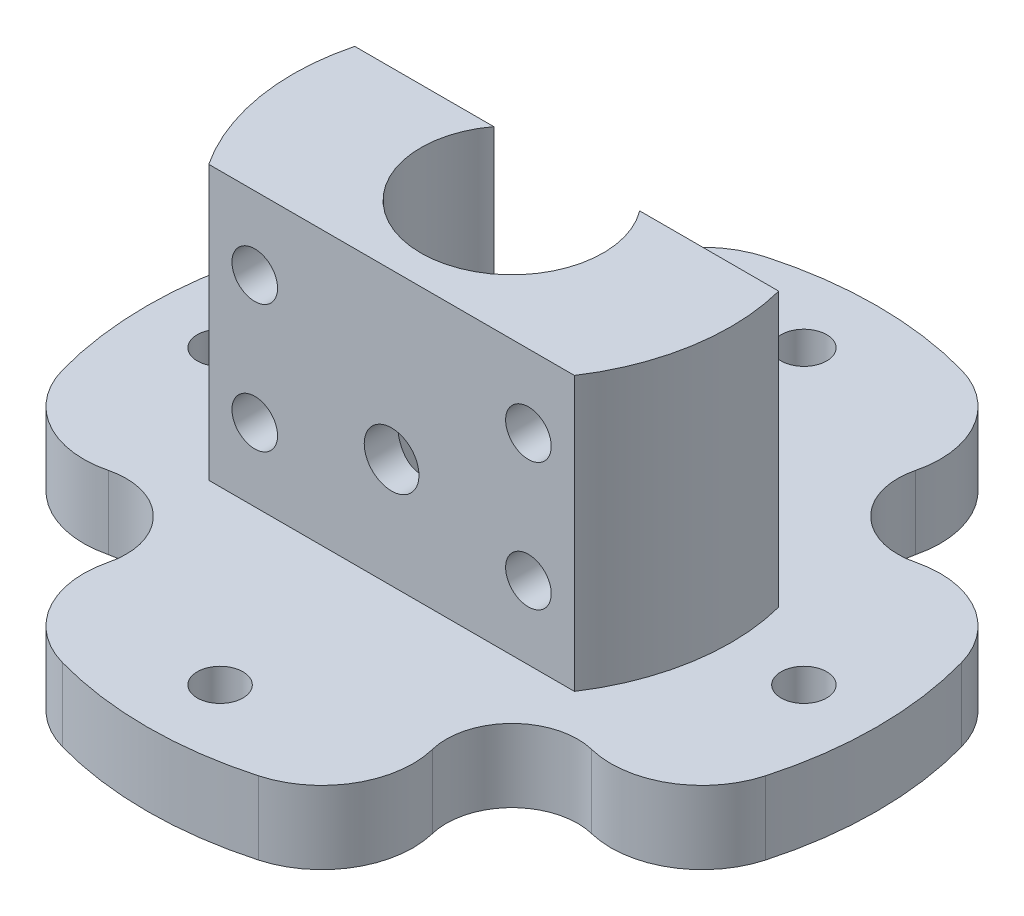
from build123d import *
from build123d.topology import SkipClean

# Parameters (mm, degrees)
EXTRUDE_1_DEPTH     = 15
EXTRUDE_START       = -4
SKETCH_3_R          = 20
SKETCH_3_R_2        = 1.25
SKETCH_3_R_3        = 5
EXTRUDE_2_DEPTH     = 4
SKETCH_4_R          = 3.6
CUT_EXTRUDE_1_DEPTH = 33.015621
FILLET_1_R          = 5
SKETCH_5_R          = 1.25
SKETCH_5_R_2        = 1.5
CUT_EXTRUDE_2_DEPTH = 34.970576


with BuildPart() as part:
    # 草图2 → 凸台-拉伸1 (new body)
    with BuildSketch(Plane(origin=(0, 0, 0), x_dir=(1, 0, 0), z_dir=(0, 1, 0))):
        with BuildLine():
            Line((-10.021976, -6.6), (10.021976, -6.6))
            ThreePointArc((10.021976, -6.6), (11.837332, -1.969158), (11.61895, 3))
            Line((11.61895, 3), (4, 3))
            ThreePointArc((4, 3), (0, -5), (-4, 3))
            Line((-4, 3), (-11.61895, 3))
            ThreePointArc((-11.61895, 3), (-11.837332, -1.969158), (-10.021976, -6.6))
        make_face()
    extrude(amount=EXTRUDE_1_DEPTH)

    # 草图3 → 凸台-拉伸2 (add)
    with SkipClean():  # the faces are left unmerged after this step: merging them gives an invalid solid
        with BuildSketch(Plane(origin=(0, 0, 0), x_dir=(1, 0, 0), z_dir=(0, 1, 0)).offset(EXTRUDE_START)):
            with Locations(Location((0, 0, 0), (0, 0, 270))):
                Circle(SKETCH_3_R)
            with Locations(Location((0, -16, 0), (0, 0, 270))):
                Circle(SKETCH_3_R_2, mode=Mode.SUBTRACT)
            with Locations(Location((16, 0, 0), (0, 0, 270))):
                Circle(SKETCH_3_R_2, mode=Mode.SUBTRACT)
            with Locations(Location((-16, 0, 0), (0, 0, 270))):
                Circle(SKETCH_3_R_2, mode=Mode.SUBTRACT)
            with Locations(Location((0, 16, 0), (0, 0, 270))):
                Circle(SKETCH_3_R_2, mode=Mode.SUBTRACT)
            with Locations(Location((0, 0, 0), (0, 0, 143.130102))):
                Circle(SKETCH_3_R_3, mode=Mode.SUBTRACT)
        extrude(amount=EXTRUDE_2_DEPTH)

    # 草图4 → 切除-拉伸1 (cut, through all)
    with SkipClean():  # the faces are left unmerged after this step: merging them gives an invalid solid
        with BuildSketch(Plane(origin=(0, 0, 0), x_dir=(1, 0, 0), z_dir=(0, 1, 0))):
            with Locations((12.374369, -12.374369)):
                Circle(SKETCH_4_R)
            with Locations((12.374369, 12.374369)):
                Circle(SKETCH_4_R)
            with Locations((-12.374369, 12.374369)):
                Circle(SKETCH_4_R)
            with Locations((-12.374369, -12.374369)):
                Circle(SKETCH_4_R)
        extrude(amount=-CUT_EXTRUDE_1_DEPTH, mode=Mode.SUBTRACT)

    # 圆角1
    fillet_1_edges = [part.edges().sort_by_distance(p)[0] for p in [
        (-12.053138, -2, 15.960008),
        (-15.960008, -2, 12.053138),
        (-15.960008, -2, -12.053138),
        (-12.053138, -2, -15.960008),
        (12.053138, -2, -15.960008),
        (15.960008, -2, -12.053138),
        (15.960008, -2, 12.053138),
        (12.053138, -2, 15.960008),
    ]]
    fillet(fillet_1_edges, radius=FILLET_1_R)

    # 草图5 → 切除-拉伸2 (cut, through all)
    with SkipClean():  # the faces are left unmerged after this step: merging them gives an invalid solid
        with BuildSketch(Plane(origin=(0, 0, -3), x_dir=(-1, 0, 0), z_dir=(0, 0, -1))):
            with Locations((-7.5, 11)):
                Circle(SKETCH_5_R)
            with Locations((-7.5, 4)):
                Circle(SKETCH_5_R)
            with Locations((7.5, 11)):
                Circle(SKETCH_5_R)
            with Locations((7.5, 4)):
                Circle(SKETCH_5_R)
            with Locations((0, 6)):
                Circle(SKETCH_5_R_2)
        extrude(amount=-CUT_EXTRUDE_2_DEPTH, mode=Mode.SUBTRACT)


solid = part.part
